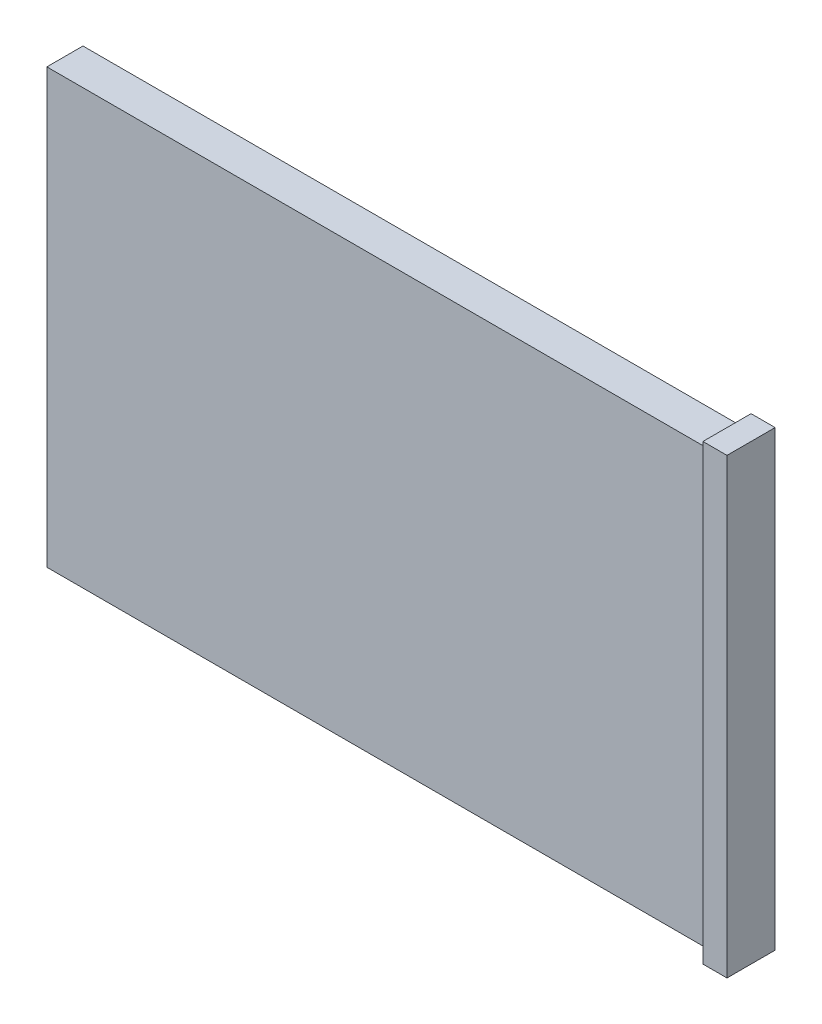
from build123d import *

# Parameters (mm, degrees)
SKETCH_1_W      = 27.5
SKETCH_1_H      = 18
EXTRUDE_1_DEPTH = 1.5
SKETCH_2_W      = 2
SKETCH_2_H      = 18.8
EXTRUDE_2_DEPTH = 1


with BuildPart() as part:
    # Эскиз1 → Бобышка-Вытянуть1 (new body)
    with BuildSketch(Plane.XY):
        Rectangle(SKETCH_1_W, SKETCH_1_H)
    extrude(amount=EXTRUDE_1_DEPTH)

    # Эскиз2 → Бобышка-Вытянуть2 (add)
    with BuildSketch(Plane(origin=(13.75, 0, 0), x_dir=(0, 0, -1), z_dir=(1, 0, 0))):
        with Locations((-0.75, 0)):
            Rectangle(SKETCH_2_W, SKETCH_2_H)
    extrude(amount=EXTRUDE_2_DEPTH)


solid = part.part
